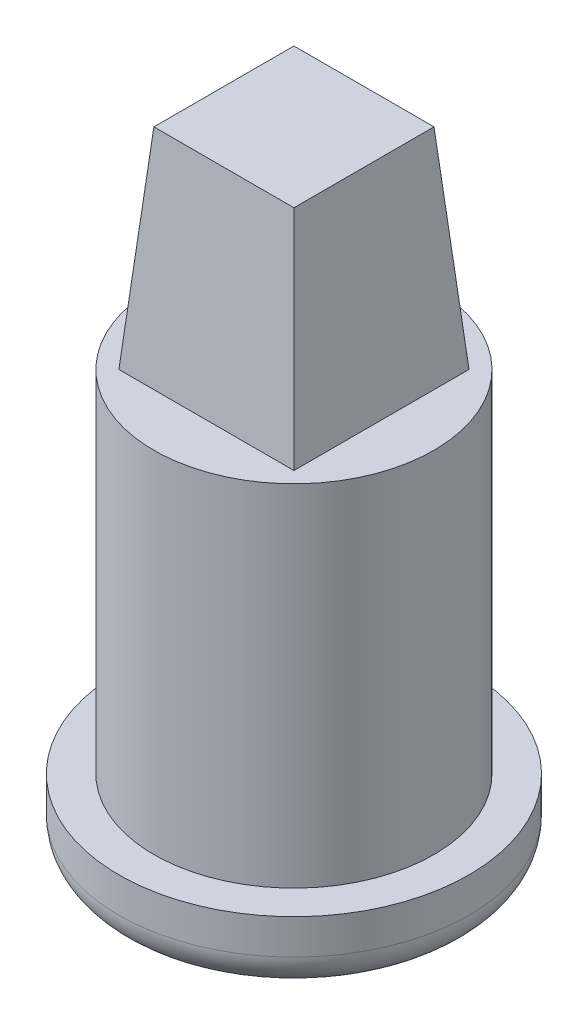
from build123d import *


with BuildPart() as part:
    # Sketch1 → Revolve1 (revolve)
    with BuildSketch(Plane.XY, mode=Mode.PRIVATE) as revolve1_sk:
        with BuildLine():
            Line((0, 0), (0, 24))
            Line((0, 24), (8, 24))
            Line((8, 24), (8, 4))
            Line((8, 4), (10, 4))
            Line((10, 4), (10, 2))
            ThreePointArc((10, 2), (9.414213562, 0.585786438), (8, 0))
            Line((8, 0), (0, 0))
        make_face()
    revolve(revolve1_sk.sketch.rotate(Axis((0, 0, 0), (0, 1, 0)), 90), axis=Axis((0, 0, 0), (0, 1, 0)))

    # Sketch3 → Loft1 section 0
    with BuildSketch(Plane(origin=(0, 36, 0), x_dir=(1, 0, 0), z_dir=(0, 1, 0))):
        with BuildLine():
            Line((-4, -4), (4, -4))
            Line((4, -4), (4, 4))
            Line((4, 4), (-4, 4))
            Line((-4, 4), (-4, -4))
        make_face()
    # Sketch2 → Loft1 section 1
    with BuildSketch(Plane(origin=(0, 24, 0), x_dir=(1, 0, 0), z_dir=(0, 1, 0))):
        with BuildLine():
            Line((-5, -5), (5, -5))
            Line((5, -5), (5, 5))
            Line((5, 5), (-5, 5))
            Line((-5, 5), (-5, -5))
        make_face()
    loft()


solid = part.part
